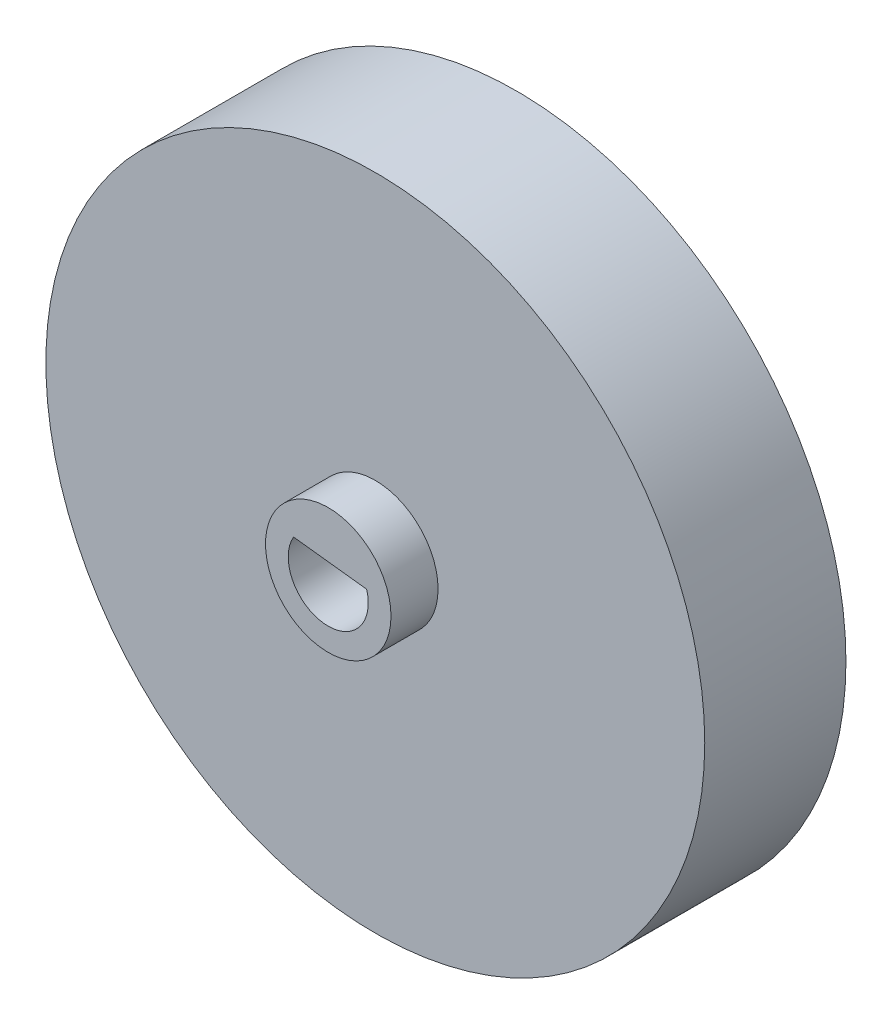
from build123d import *

# Parameters (mm, degrees)
SKETCH_1_R      = 8
EXTRUDE_1_DEPTH = 24
SKETCH_2_R      = 42
SKETCH_2_R_2    = 8
EXTRUDE_2_DEPTH = 18


with BuildPart() as part:
    # 草图1 → 凸台-拉伸1 (new body)
    with BuildSketch(Plane.XY):
        Circle(SKETCH_1_R)
        with BuildLine():
            Line((4.89403723, 1.434712371), (-4.42388764, 2.537561456))
            ThreePointArc((-4.42388764, 2.537561456), (-0.599440727, -5.06464913), (4.89403723, 1.434712371))
        make_face(mode=Mode.SUBTRACT)
    extrude(amount=EXTRUDE_1_DEPTH)

    # 草图2 → 凸台-拉伸2 (add)
    with BuildSketch(Plane.XY):
        Circle(SKETCH_2_R)
        Circle(SKETCH_2_R_2, mode=Mode.SUBTRACT)
    extrude(amount=EXTRUDE_2_DEPTH)


solid = part.part
